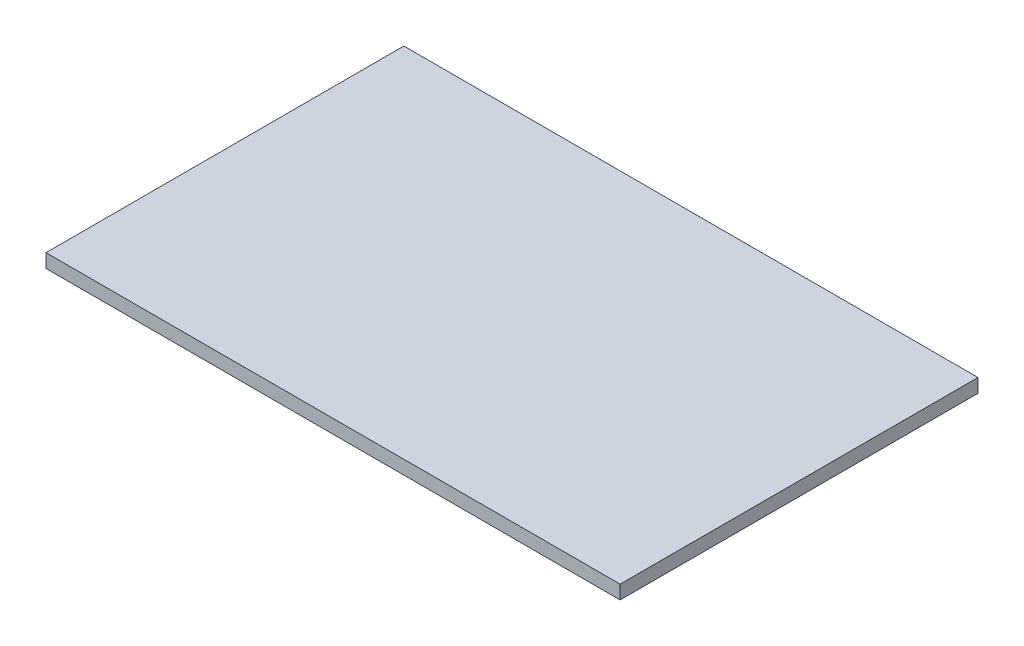
from build123d import *

# Parameters (mm, degrees)
SKETCH1_W           = 754
SKETCH1_H           = 470
BOSS_EXTRUDE1_DEPTH = 18


with BuildPart() as part:
    # Sketch1 → Boss-Extrude1 (new body)
    with BuildSketch(Plane(origin=(0, 0, 0), x_dir=(1, 0, 0), z_dir=(0, 1, 0))):
        Rectangle(SKETCH1_W, SKETCH1_H)
    extrude(amount=BOSS_EXTRUDE1_DEPTH)


solid = part.part
